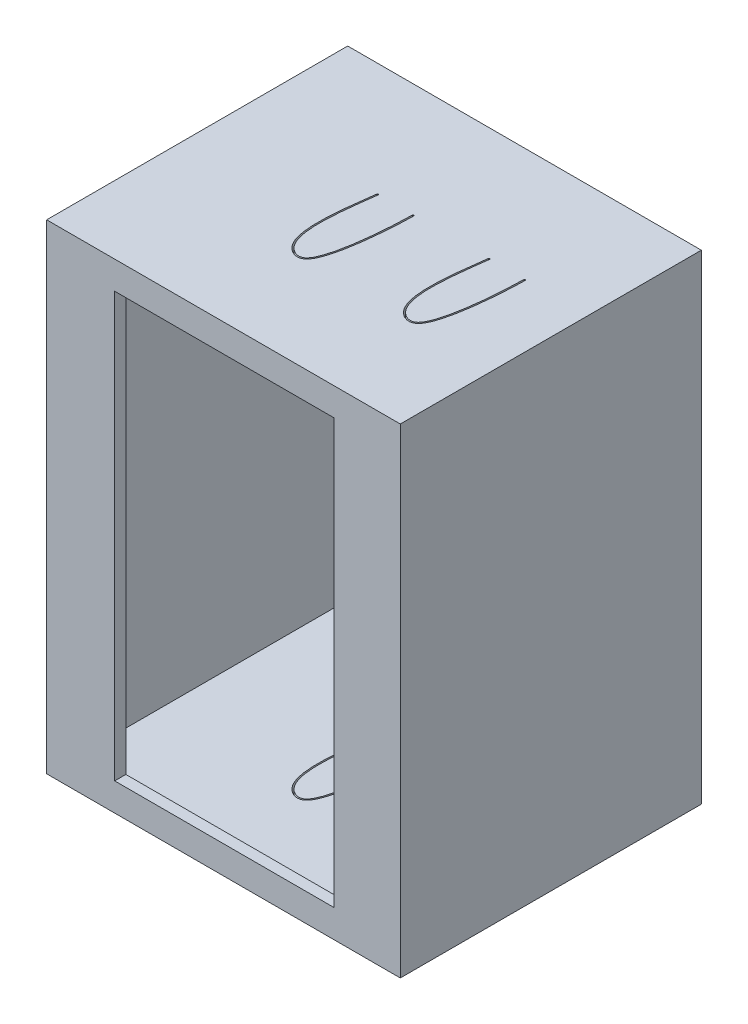
from build123d import *

# Parameters (mm, degrees)
SKETCH1_W           = 47.540146649
SKETCH1_H           = 64.5
SKETCH1_W_2         = 44.540146649
SKETCH1_H_2         = 61.5
SKETCH1_W_3         = 29.49
SKETCH1_H_3         = 57.01
BOSS_EXTRUDE1_DEPTH = 1.5
SKETCH1_3_W         = 47.540146649
SKETCH1_3_H         = 64.5
SKETCH1_3_W_2       = 44.540146649
SKETCH1_3_H_2       = 61.5
BOSS_EXTRUDE2_DEPTH = 37.470608401
BOSS_EXTRUDE3_START = -37.470608
SKETCH1_4_W         = 47.540146649
SKETCH1_4_H         = 64.5
BOSS_EXTRUDE3_DEPTH = 1.5
SKETCH2_R           = 10.134454574
SKETCH2_W           = 14.188727537
SKETCH2_H           = 7.847532525
CUT_EXTRUDE1_DEPTH  = 0.5
CUT_EXTRUDE2_DEPTH  = 80.055027638


with BuildPart() as part:
    # Sketch1 → Boss-Extrude1 (new body)
    # profile 1 of 2: a face of its own
    with BuildSketch(Plane.XY):
        with Locations((-0.120073324, -0.005)):
            Rectangle(SKETCH1_W, SKETCH1_H)
        with Locations((-0.120073324, -0.005)):
            Rectangle(SKETCH1_W_2, SKETCH1_H_2, mode=Mode.SUBTRACT)
    # profile 2 of 2: a face of its own
    with BuildSketch(Plane.XY):
        with Locations((-0.120073324, -0.005)):
            Rectangle(SKETCH1_W_2, SKETCH1_H_2)
        Rectangle(SKETCH1_W_3, SKETCH1_H_3, mode=Mode.SUBTRACT)
    extrude(amount=BOSS_EXTRUDE1_DEPTH)

    # Sketch1<3> → Boss-Extrude2 (add)
    with BuildSketch(Plane.XY):
        with Locations((-0.120073324, -0.005)):
            Rectangle(SKETCH1_3_W, SKETCH1_3_H)
        with Locations((-0.120073324, -0.005)):
            Rectangle(SKETCH1_3_W_2, SKETCH1_3_H_2, mode=Mode.SUBTRACT)
    extrude(amount=-BOSS_EXTRUDE2_DEPTH)

    # Sketch1<4> → Boss-Extrude3 (add)
    with BuildSketch(Plane.XY.offset(BOSS_EXTRUDE3_START)):
        with Locations((-0.120073324, -0.005)):
            Rectangle(SKETCH1_4_W, SKETCH1_4_H)
    extrude(amount=-BOSS_EXTRUDE3_DEPTH)

    # Sketch2 → Cut-Extrude1 (cut)
    with BuildSketch(Plane.ZY.offset(23.890146649)):
        with Locations((-21.3, 10.4)):
            Circle(SKETCH2_R)
        with Locations((-18.654138798, -15.68752811)):
            Rectangle(SKETCH2_W, SKETCH2_H)
    extrude(amount=-CUT_EXTRUDE1_DEPTH, mode=Mode.SUBTRACT)

    # Sketch5 → Cut-Extrude2 (cut, through all)
    with BuildSketch(Plane(origin=(0, 32.245, 0), x_dir=(1, 0, 0), z_dir=(0, 1, 0))):
        with BuildLine():
            ThreePointArc((-4.504763763, 23.666162391), (-4.590403655, 23.778704867), (-4.702946131, 23.693064975))
            add(Edge.make_bspline(
                [(-4.702946131, 23.693064975), (-4.790106315, 23.050984953), (-4.962687388, 21.75716288), (-5.255273142, 19.237935068), (-5.453646154, 16.287371006), (-5.236345515, 13.859960097), (-4.67934887, 12.363742475), (-4.025443593, 11.515608924), (-3.242790244, 11.052878316), (-2.498283195, 11.002606195), (-1.757058888, 11.33810277), (-1.107050331, 12.462452992), (-0.527393804, 14.537490426), (-0.117334173, 17.053813589), (0.106052259, 19.227269297), (0.224655195, 20.840375325), (0.286384288, 21.945486284), (0.317365105, 22.737956376), (0.331346059, 23.285327543), (0.334775371, 23.506422378), (0.335841667, 23.623556997)],
                knots=[0, 0, 0, 0, 0.0625, 0.125, 0.25, 0.375, 0.4375, 0.5, 0.5625, 0.59375, 0.625, 0.6875, 0.75, 0.8125, 0.875, 0.90625, 0.9375, 0.96875, 0.984375, 1, 1, 1, 1], degree=3))
            ThreePointArc((0.335841667, 23.623556997), (0.236756089, 23.724463133), (0.135849953, 23.625377555))
            add(Edge.make_bspline(
                [(-4.504763763, 23.666162391), (-5.239177146, 18.255983801), (-5.974252212, 11.90118578), (-0.497301677, 10.602173067), (0.112470193, 21.057067053), (0.135849953, 23.625377555)],
                knots=[0, 0, 0, 0, 0.524282028, 0.624282028, 1, 1, 1, 1], degree=3))
        make_face()
        with BuildLine():
            ThreePointArc((15.135849953, 23.625377555), (15.236756089, 23.724463133), (15.335841667, 23.623556997))
            add(Edge.make_bspline(
                [(10.297053869, 23.693064975), (10.209893685, 23.050984953), (10.037312612, 21.75716288), (9.744726858, 19.237935068), (9.546353846, 16.287371006), (9.763654485, 13.859960097), (10.32065113, 12.363742475), (10.974556407, 11.515608924), (11.757209756, 11.052878316), (12.501716805, 11.002606195), (13.242941112, 11.33810277), (13.892949669, 12.462452992), (14.472606196, 14.537490426), (14.882665827, 17.053813589), (15.106052259, 19.227269297), (15.224655195, 20.840375325), (15.286384288, 21.945486284), (15.317365105, 22.737956376), (15.331346059, 23.285327543), (15.334775371, 23.506422378), (15.335841667, 23.623556997)],
                knots=[0, 0, 0, 0, 0.0625, 0.125, 0.25, 0.375, 0.4375, 0.5, 0.5625, 0.59375, 0.625, 0.6875, 0.75, 0.8125, 0.875, 0.90625, 0.9375, 0.96875, 0.984375, 1, 1, 1, 1], degree=3))
            ThreePointArc((10.297053869, 23.693064975), (10.409596345, 23.778704867), (10.495236237, 23.666162391))
            add(Edge.make_bspline(
                [(10.495236237, 23.666162391), (9.760822854, 18.255983801), (9.025747788, 11.90118578), (14.502698323, 10.602173067), (15.112470193, 21.057067053), (15.135849953, 23.625377555)],
                knots=[0, 0, 0, 0, 0.524282028, 0.624282028, 1, 1, 1, 1], degree=3))
        make_face()
    extrude(amount=-CUT_EXTRUDE2_DEPTH, mode=Mode.SUBTRACT)


solid = part.part
